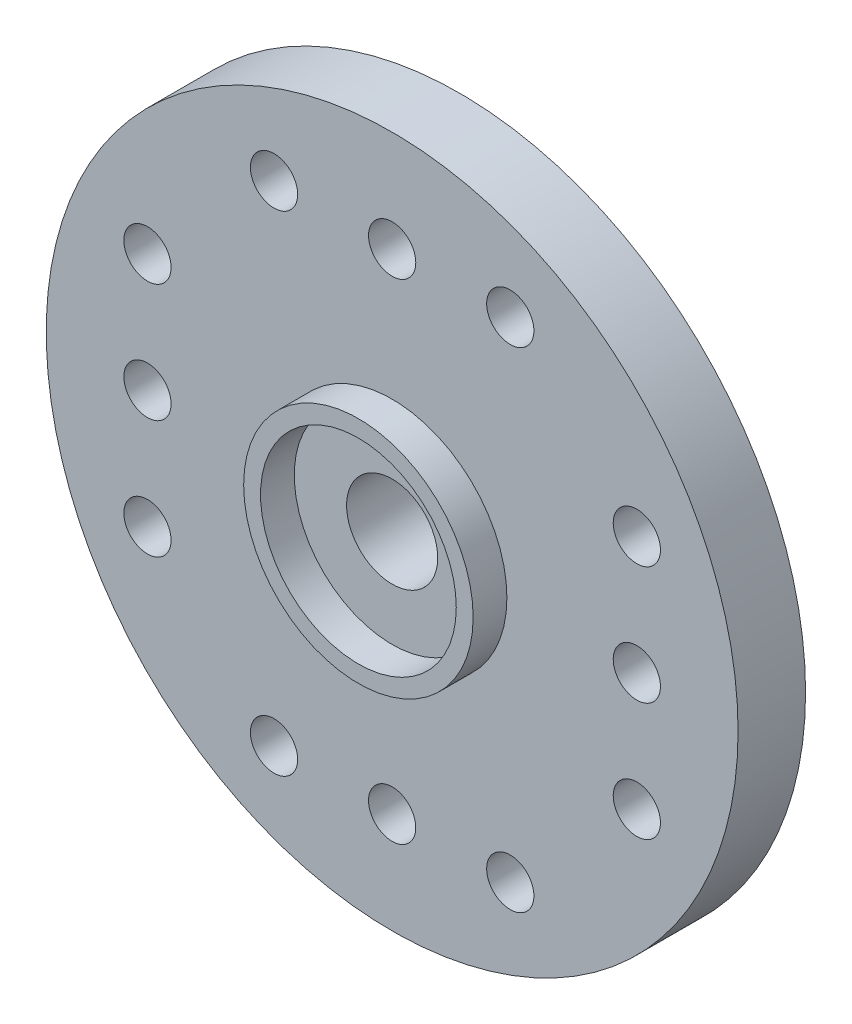
from build123d import *

# Parameters (mm, degrees)
SKETCH1_R           = 10.25
BOSS_EXTRUDE1_DEPTH = 2
SKETCH2_R           = 3.4
SKETCH2_R_2         = 2.9
BOSS_EXTRUDE2_DEPTH = 1
SKETCH3_R           = 1.35
CUT_EXTRUDE1_DEPTH  = 15.633010627
SKETCH4_R           = 0.7
CUT_EXTRUDE2_DEPTH  = 15.633010627
CIRPATTERN1_COUNT   = 4
SKETCH5_R           = 4.85
SKETCH5_R_2         = 2.7
BOSS_EXTRUDE3_DEPTH = 3


with BuildPart() as part:
    # Sketch1 → Boss-Extrude1 (new body)
    with BuildSketch(Plane.XY):
        Circle(SKETCH1_R)
    extrude(amount=BOSS_EXTRUDE1_DEPTH)

    # Sketch2 → Boss-Extrude2 (add)
    with BuildSketch(Plane.XY.offset(2)):
        Circle(SKETCH2_R)
        Circle(SKETCH2_R_2, mode=Mode.SUBTRACT)
    extrude(amount=BOSS_EXTRUDE2_DEPTH)

    # Sketch3 → Cut-Extrude1 (cut, through all)
    with BuildSketch(Plane.XY.offset(2)):
        Circle(SKETCH3_R)
    extrude(amount=-CUT_EXTRUDE1_DEPTH, mode=Mode.SUBTRACT)

    # Sketch4 → Cut-Extrude2 (cut, through all)
    with BuildSketch(Plane.XY.offset(2)):
        with Locations((0, 7.25)):
            Circle(SKETCH4_R)
        with Locations((3.5, 7.25)):
            Circle(SKETCH4_R)
        with Locations(Location((-3.5, 7.25, 0), (0, 0, 180))):
            Circle(SKETCH4_R)
        with Locations((-3.5, -7.25)):
            Circle(SKETCH4_R)
        with Locations(Location((3.5, -7.25, 0), (0, 0, 180))):
            Circle(SKETCH4_R)
        with Locations(Location((0, -7.25, 0), (0, 0, 180))):
            Circle(SKETCH4_R)
    cut_extrude2 = extrude(amount=-CUT_EXTRUDE2_DEPTH, mode=Mode.SUBTRACT)

    # CirPattern1: Cut-Extrude2 ×4 about axis
    cirpattern1_axis = Axis((0, 0, 0), (0, 0, 1))
    for i in range(1, CIRPATTERN1_COUNT):
        add(cut_extrude2.rotate(cirpattern1_axis, i * 360 / CIRPATTERN1_COUNT), mode=Mode.SUBTRACT)

    # Sketch5 → Boss-Extrude3 (add)
    with BuildSketch(Plane(origin=(0, 0, 0), x_dir=(-1, 0, 0), z_dir=(0, 0, -1))):
        with Locations(Location((0, 0, 0), (0, 0, 180))):
            Circle(SKETCH5_R)
        Circle(SKETCH5_R_2, mode=Mode.SUBTRACT)
    extrude(amount=BOSS_EXTRUDE3_DEPTH)


solid = part.part
